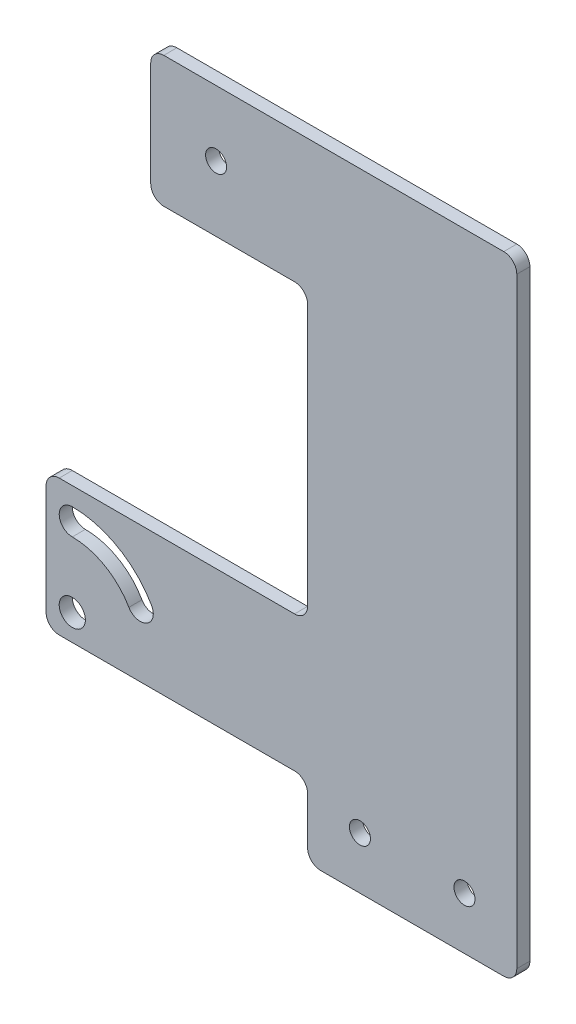
from build123d import *

# Parameters (mm, degrees)
SKETCH1_R           = 3.175
SKETCH1_R_2         = 2.5527
BOSS_EXTRUDE1_DEPTH = 3.175
BOSS_EXTRUDE2_DEPTH = 3.175
FILLET1_R           = 3.175
SKETCH2_R           = 2.5527
CUT_EXTRUDE1_DEPTH  = 25.4


with BuildPart() as part:
    # Sketch1 → Boss-Extrude1 (new body)
    with BuildSketch(Plane.XY):
        Polygon((-63.5, 17.78), (0, 17.78), (0, 0), (50.8, 0), (50.8, 50.8), (-63.5, 50.8), align=None)
        with Locations((-57.15, 24.13)):
            Circle(SKETCH1_R, mode=Mode.SUBTRACT)
        with BuildLine():
            ThreePointArc((-57.15, 46.355), (-46.0375, 43.377414599), (-37.902585401, 35.2425))
            ThreePointArc((-37.902585401, 35.2425), (-39.064716058, 30.905369343), (-43.401846715, 32.0675))
            ThreePointArc((-43.401846715, 32.0675), (-49.2125, 37.878153285), (-57.15, 40.005))
            ThreePointArc((-57.15, 40.005), (-60.325, 43.18), (-57.15, 46.355))
        make_face(mode=Mode.SUBTRACT)
        with Locations((38.1, 12.7)):
            Circle(SKETCH1_R_2, mode=Mode.SUBTRACT)
        with Locations((12.7, 12.7)):
            Circle(SKETCH1_R_2, mode=Mode.SUBTRACT)
    extrude(amount=BOSS_EXTRUDE1_DEPTH)

    # Sketch1<4> → Boss-Extrude2 (add)
    with BuildSketch(Plane.XY):
        Polygon((0, 120.65), (0, 50.8), (50.8, 50.8), (50.8, 152.4), (-38.1, 152.4), (-38.1, 120.65), align=None)
    extrude(amount=BOSS_EXTRUDE2_DEPTH)

    # Fillet1
    fillet1_edges = [part.edges().sort_by_distance(p)[0] for p in [
        (50.8, 152.4, 1.5875),
        (50.8, 0, 1.5875),
        (0, 0, 1.5875),
        (0, 17.78, 1.5875),
        (-63.5, 17.78, 1.5875),
        (-63.5, 50.8, 1.5875),
        (0, 50.8, 1.5875),
        (0, 120.65, 1.5875),
        (-38.1, 120.65, 1.5875),
        (-38.1, 152.4, 1.5875),
    ]]
    fillet(fillet1_edges, radius=FILLET1_R)

    # Sketch2 → Cut-Extrude1 (cut)
    with BuildSketch(Plane.XY.offset(3.175)):
        with Locations((-22.225, 136.525)):
            Circle(SKETCH2_R)
    extrude(amount=-CUT_EXTRUDE1_DEPTH, mode=Mode.SUBTRACT)


solid = part.part
